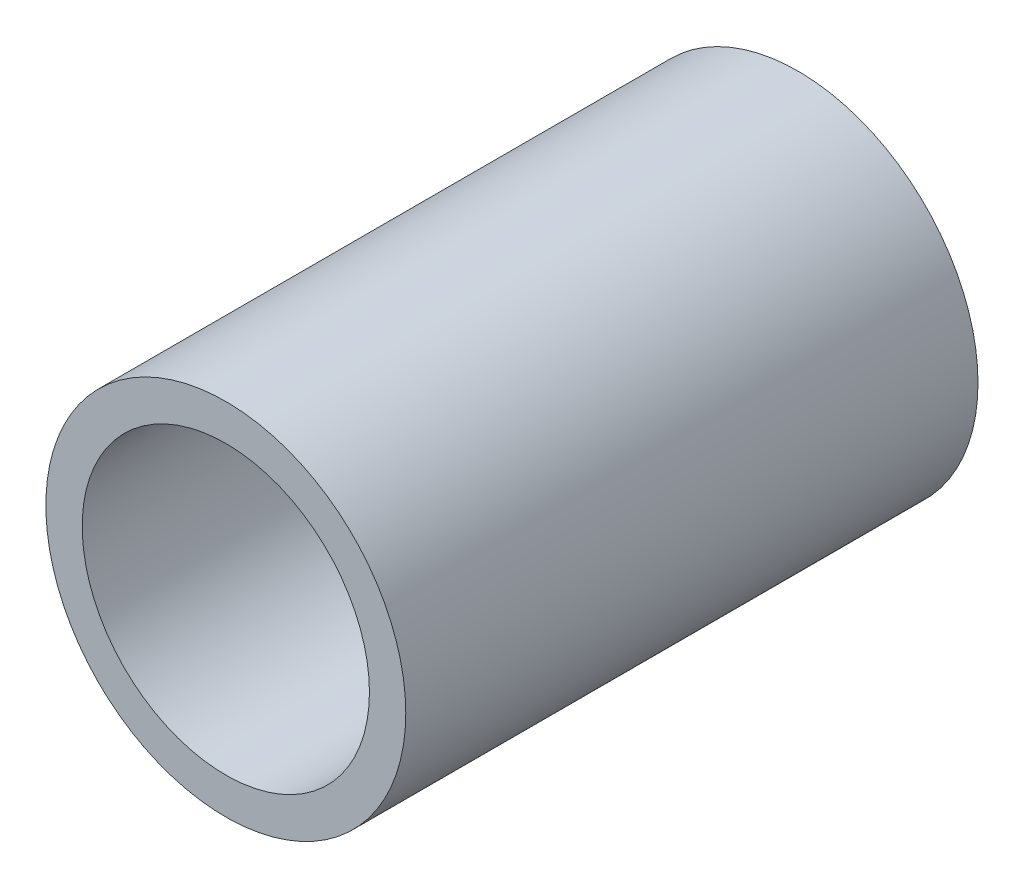
from build123d import *

# Parameters (mm, degrees)
BOSS_EXTRUDE1_DEPTH      = 6.35
BOSS_EXTRUDE1_DEPTH_BACK = 6.35
SKETCH5_R                = 3.99415
SKETCH5_R_2              = 3.1877


with BuildPart() as part:
    # Sketch5 → Boss-Extrude1 (new, two sides: drawn at the far end of the back side and taken through both)
    with BuildSketch(Plane.XY.offset(-BOSS_EXTRUDE1_DEPTH_BACK)):
        Circle(SKETCH5_R)
        Circle(SKETCH5_R_2, mode=Mode.SUBTRACT)
    extrude(amount=BOSS_EXTRUDE1_DEPTH + BOSS_EXTRUDE1_DEPTH_BACK)


solid = part.part
